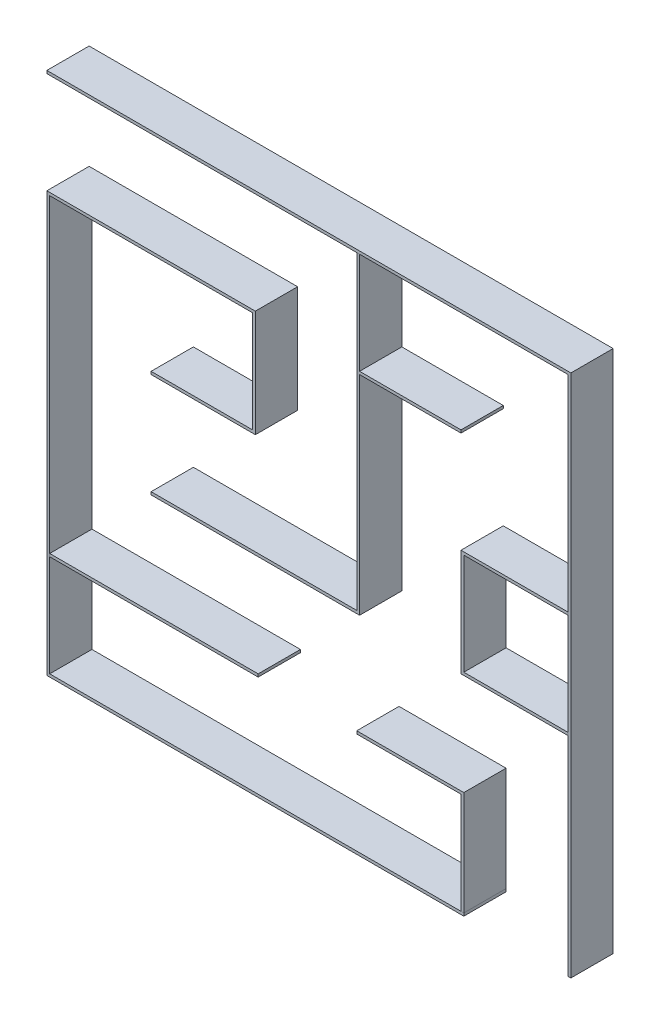
from build123d import *

# Parameters (mm, degrees)
SKETCH1_W           = 1860
SKETCH1_H           = 1860
BOSS_EXTRUDE1_DEPTH = 10
SKETCH2_W           = 1860
SKETCH2_H           = 1860
SKETCH2_W_2         = 1840
SKETCH2_H_2         = 1840
EXTRUDE_THIN1_DEPTH = 150
SKETCH3_W           = 1840
SKETCH3_H           = 10
BOSS_EXTRUDE2_DEPTH = 150
LPATTERN1_COUNT     = 4
LPATTERN1_PITCH     = 370
SKETCH4_W           = 10
SKETCH4_H           = 1840
BOSS_EXTRUDE3_DEPTH = 150
LPATTERN2_COUNT     = 4
LPATTERN2_PITCH     = 370
SKETCH8_W           = 370
SKETCH8_H           = 10
CUT_EXTRUDE6_DEPTH  = 150
SKETCH9_W           = 370
SKETCH9_H           = 10
CUT_EXTRUDE7_DEPTH  = 150
SKETCH10_W          = 360
SKETCH10_H          = 10
CUT_EXTRUDE8_DEPTH  = 150
SKETCH11_W          = 360
SKETCH11_H          = 10
CUT_EXTRUDE9_DEPTH  = 150
SKETCH12_W          = 10
SKETCH12_H          = 730
CUT_EXTRUDE10_DEPTH = 150
SKETCH13_W          = 10
SKETCH13_H          = 360
CUT_EXTRUDE11_DEPTH = 150
SKETCH14_W          = 10
SKETCH14_H          = 360
CUT_EXTRUDE12_DEPTH = 150
SKETCH15_W          = 10
SKETCH15_H          = 360
CUT_EXTRUDE13_DEPTH = 150
SKETCH16_W          = 10
SKETCH16_H          = 360
CUT_EXTRUDE14_DEPTH = 150
SKETCH17_W          = 350
SKETCH17_H          = 10
CUT_EXTRUDE15_DEPTH = 150
SKETCH18_W          = 10
SKETCH18_H          = 360
CUT_EXTRUDE16_DEPTH = 150
SKETCH19_W          = 10
SKETCH19_H          = 360
CUT_EXTRUDE17_DEPTH = 150
SKETCH20_W          = 10
SKETCH20_H          = 730
CUT_EXTRUDE18_DEPTH = 150
SKETCH21_W          = 350
SKETCH21_H          = 10
CUT_EXTRUDE19_DEPTH = 150
SKETCH22_W          = 10
SKETCH22_H          = 360
CUT_EXTRUDE20_DEPTH = 150
SKETCH23_W          = 350
SKETCH23_H          = 10
CUT_EXTRUDE21_DEPTH = 150
SKETCH24_W          = 360.035966522
SKETCH24_H          = 10
CUT_EXTRUDE22_DEPTH = 150
SKETCH25_W          = 10
SKETCH25_H          = 360
CUT_EXTRUDE23_DEPTH = 150
SKETCH26_W          = 10
SKETCH26_H          = 360
CUT_EXTRUDE24_DEPTH = 150
SKETCH27_W          = 360
SKETCH27_H          = 10
CUT_EXTRUDE25_DEPTH = 150
SKETCH28_W          = 370
SKETCH28_H          = 10
CUT_EXTRUDE26_DEPTH = 150
SKETCH30_W          = 10
SKETCH30_H          = 370
CUT_EXTRUDE29_DEPTH = 150
SKETCH31_W          = 10
SKETCH31_H          = 360
CUT_EXTRUDE30_DEPTH = 150
SKETCH32_W          = 1860
SKETCH32_H          = 1860
CUT_EXTRUDE33_DEPTH = 10
SKETCH33_W          = 10
SKETCH33_H          = 10
CUT_EXTRUDE34_DEPTH = 1324.744688375
SKETCH34_W          = 150
SKETCH34_H          = 10
BOSS_EXTRUDE4_DEPTH = 10


with BuildPart() as part:
    # Sketch1 → Boss-Extrude1 (new body)
    with BuildSketch(Plane.XY):
        Rectangle(SKETCH1_W, SKETCH1_H)
    extrude(amount=BOSS_EXTRUDE1_DEPTH)

    # Sketch3 → Boss-Extrude2 (add)
    with BuildSketch(Plane.XY.offset(10)):
        with Locations((0, -555)):
            Rectangle(SKETCH3_W, SKETCH3_H)
    boss_extrude2 = extrude(amount=BOSS_EXTRUDE2_DEPTH)

    # LPattern1: Boss-Extrude2 ×4
    with Locations(*[(0, i * LPATTERN1_PITCH, 0) for i in range(1, LPATTERN1_COUNT)]):
        add(boss_extrude2)

    # Sketch4 → Boss-Extrude3 (add)
    with BuildSketch(Plane.XY.offset(10)):
        with Locations((545, 0)):
            Rectangle(SKETCH4_W, SKETCH4_H)
    boss_extrude3 = extrude(amount=BOSS_EXTRUDE3_DEPTH)

    # LPattern2: Boss-Extrude3 ×4
    with Locations(*[(-i * LPATTERN2_PITCH, 0, 0) for i in range(1, LPATTERN2_COUNT)]):
        add(boss_extrude3)

    # Sketch8 → Cut-Extrude6 (cut)
    with BuildSketch(Plane.XY.offset(160)):
        with Locations((735, -555)):
            Rectangle(SKETCH8_W, SKETCH8_H)
    extrude(amount=-CUT_EXTRUDE6_DEPTH, mode=Mode.SUBTRACT)

    # Sketch9 → Cut-Extrude7 (cut)
    with BuildSketch(Plane.XY.offset(160)):
        with Locations((735, 555)):
            Rectangle(SKETCH9_W, SKETCH9_H)
    extrude(amount=-CUT_EXTRUDE7_DEPTH, mode=Mode.SUBTRACT)

    # Sketch10 → Cut-Extrude8 (cut)
    with BuildSketch(Plane.XY.offset(160)):
        with Locations((360, 185)):
            Rectangle(SKETCH10_W, SKETCH10_H)
    extrude(amount=-CUT_EXTRUDE8_DEPTH, mode=Mode.SUBTRACT)

    # Sketch11 → Cut-Extrude9 (cut)
    with BuildSketch(Plane.XY.offset(160)):
        with Locations((360, -185)):
            Rectangle(SKETCH11_W, SKETCH11_H)
    extrude(amount=-CUT_EXTRUDE9_DEPTH, mode=Mode.SUBTRACT)

    # Sketch12 → Cut-Extrude10 (cut)
    with BuildSketch(Plane.XY.offset(160)):
        with Locations((545, 555)):
            Rectangle(SKETCH12_W, SKETCH12_H)
    extrude(amount=-CUT_EXTRUDE10_DEPTH, mode=Mode.SUBTRACT)

    # Sketch13 → Cut-Extrude11 (cut)
    with BuildSketch(Plane.XY.offset(160)):
        with Locations((545, -370)):
            Rectangle(SKETCH13_W, SKETCH13_H)
    extrude(amount=-CUT_EXTRUDE11_DEPTH, mode=Mode.SUBTRACT)

    # Sketch14 → Cut-Extrude12 (cut)
    with BuildSketch(Plane.XY.offset(160)):
        with Locations((-565, -740)):
            Rectangle(SKETCH14_W, SKETCH14_H)
    extrude(amount=-CUT_EXTRUDE12_DEPTH, mode=Mode.SUBTRACT)

    # Sketch15 → Cut-Extrude13 (cut)
    with BuildSketch(Plane.XY.offset(160)):
        with Locations((-195, -740)):
            Rectangle(SKETCH15_W, SKETCH15_H)
    extrude(amount=-CUT_EXTRUDE13_DEPTH, mode=Mode.SUBTRACT)

    # Sketch16 → Cut-Extrude14 (cut)
    with BuildSketch(Plane.XY.offset(160)):
        with Locations((175, -740)):
            Rectangle(SKETCH16_W, SKETCH16_H)
    extrude(amount=-CUT_EXTRUDE14_DEPTH, mode=Mode.SUBTRACT)

    # Sketch17 → Cut-Extrude15 (cut)
    with BuildSketch(Plane.XY.offset(160)):
        with Locations((-5, -555)):
            Rectangle(SKETCH17_W, SKETCH17_H)
    extrude(amount=-CUT_EXTRUDE15_DEPTH, mode=Mode.SUBTRACT)

    # Sketch18 → Cut-Extrude16 (cut)
    with BuildSketch(Plane.XY.offset(160)):
        with Locations((-195, -370)):
            Rectangle(SKETCH18_W, SKETCH18_H)
    extrude(amount=-CUT_EXTRUDE16_DEPTH, mode=Mode.SUBTRACT)

    # Sketch19 → Cut-Extrude17 (cut)
    with BuildSketch(Plane.XY.offset(160)):
        with Locations((-565, -370)):
            Rectangle(SKETCH19_W, SKETCH19_H)
    extrude(amount=-CUT_EXTRUDE17_DEPTH, mode=Mode.SUBTRACT)

    # Sketch20 → Cut-Extrude18 (cut)
    with BuildSketch(Plane.XY.offset(160)):
        with Locations((-565, 185)):
            Rectangle(SKETCH20_W, SKETCH20_H)
    extrude(amount=-CUT_EXTRUDE18_DEPTH, mode=Mode.SUBTRACT)

    # Sketch21 → Cut-Extrude19 (cut)
    with BuildSketch(Plane.XY.offset(160)):
        with Locations((-745, 185)):
            Rectangle(SKETCH21_W, SKETCH21_H)
    extrude(amount=-CUT_EXTRUDE19_DEPTH, mode=Mode.SUBTRACT)

    # Sketch22 → Cut-Extrude20 (cut)
    with BuildSketch(Plane.XY.offset(160)):
        with Locations((-195, 0)):
            Rectangle(SKETCH22_W, SKETCH22_H)
    extrude(amount=-CUT_EXTRUDE20_DEPTH, mode=Mode.SUBTRACT)

    # Sketch23 → Cut-Extrude21 (cut)
    with BuildSketch(Plane.XY.offset(160)):
        with Locations((-5, 185)):
            Rectangle(SKETCH23_W, SKETCH23_H)
    extrude(amount=-CUT_EXTRUDE21_DEPTH, mode=Mode.SUBTRACT)

    # Sketch24 → Cut-Extrude22 (cut)
    with BuildSketch(Plane.XY.offset(160)):
        with Locations((-739.982016739, -185)):
            Rectangle(SKETCH24_W, SKETCH24_H)
    extrude(amount=-CUT_EXTRUDE22_DEPTH, mode=Mode.SUBTRACT)

    # Sketch25 → Cut-Extrude23 (cut)
    with BuildSketch(Plane.XY.offset(160)):
        with Locations((-565, 740)):
            Rectangle(SKETCH25_W, SKETCH25_H)
    extrude(amount=-CUT_EXTRUDE23_DEPTH, mode=Mode.SUBTRACT)

    # Sketch26 → Cut-Extrude24 (cut)
    with BuildSketch(Plane.XY.offset(160)):
        with Locations((-195, 740)):
            Rectangle(SKETCH26_W, SKETCH26_H)
    extrude(amount=-CUT_EXTRUDE24_DEPTH, mode=Mode.SUBTRACT)

    # Sketch27 → Cut-Extrude25 (cut)
    with BuildSketch(Plane.XY.offset(160)):
        with Locations((-10, 555)):
            Rectangle(SKETCH27_W, SKETCH27_H)
    extrude(amount=-CUT_EXTRUDE25_DEPTH, mode=Mode.SUBTRACT)

    # Sketch31 → Cut-Extrude30 (cut)
    with BuildSketch(Plane.XY.offset(160)):
        with Locations((175, -370)):
            Rectangle(SKETCH31_W, SKETCH31_H)
    extrude(amount=-CUT_EXTRUDE30_DEPTH, mode=Mode.SUBTRACT)

    # Sketch32 → Cut-Extrude33 (cut)
    with BuildSketch(Plane.XY.offset(10)):
        Rectangle(SKETCH32_W, SKETCH32_H)
    extrude(amount=-CUT_EXTRUDE33_DEPTH, mode=Mode.SUBTRACT)


with BuildPart() as body_2:
    # Sketch2 → Extrude-Thin1 (new body)
    with BuildSketch(Plane.XY.offset(10)):
        Rectangle(SKETCH2_W, SKETCH2_H)
        Rectangle(SKETCH2_W_2, SKETCH2_H_2, mode=Mode.SUBTRACT)
    extrude(amount=EXTRUDE_THIN1_DEPTH)

    # Sketch28 → Cut-Extrude26 (cut)
    with BuildSketch(Plane.XY.offset(160)):
        with Locations((735, -925)):
            Rectangle(SKETCH28_W, SKETCH28_H)
    extrude(amount=-CUT_EXTRUDE26_DEPTH, mode=Mode.SUBTRACT)

    # Sketch30 → Cut-Extrude29 (cut)
    with BuildSketch(Plane.XY.offset(160)):
        with Locations((-925, 735)):
            Rectangle(SKETCH30_W, SKETCH30_H)
    extrude(amount=-CUT_EXTRUDE29_DEPTH, mode=Mode.SUBTRACT)


with BuildPart() as cut_extrude29_piece_1:
    # of the separate pieces the step leaves, piece 1, a body of its own (cut_extrude29_pieces)
    add(body_2.part.solids().sort_by_distance((930, 930, 10))[0])


with BuildPart() as cut_extrude29_piece_2:
    # of the separate pieces the step leaves, piece 2, a body of its own (cut_extrude29_pieces)
    add(body_2.part.solids().sort_by_distance((-930, -930, 10))[0])



with BuildPart() as cut_extrude33_piece_1:
    # of the separate pieces the step leaves, piece 1, a body of its own (cut_extrude33_pieces)
    add(part.part.solids().sort_by_distance((-559.964033478, -180, 160))[0])


with BuildPart() as cut_extrude33_piece_2:
    # of the separate pieces the step leaves, piece 2, a body of its own (cut_extrude33_pieces)
    add(part.part.solids().sort_by_distance((-180, 190, 10))[0])

    # Sketch33 → Cut-Extrude34 (cut, through all)
    with BuildSketch(Plane(origin=(0, 0, 10), x_dir=(-1, 0, 0), z_dir=(0, 0, -1))):
        with Locations((185, 185)):
            Rectangle(SKETCH33_W, SKETCH33_H)
    extrude(amount=-CUT_EXTRUDE34_DEPTH, mode=Mode.SUBTRACT)


with BuildPart() as cut_extrude33_piece_3:
    # of the separate pieces the step leaves, piece 3, a body of its own (cut_extrude33_pieces)
    add(part.part.solids().sort_by_distance((540, -190, 160))[0])


with BuildPart() as cut_extrude33_piece_4:
    # of the separate pieces the step leaves, piece 4, a body of its own (cut_extrude33_pieces)
    add(part.part.solids().sort_by_distance((550, -550, 10))[0])


with BuildPart() as cut_extrude33_piece_5:
    # of the separate pieces the step leaves, piece 5, a body of its own (cut_extrude33_pieces)
    add(part.part.solids().sort_by_distance((-920, -550, 10))[0])


with BuildPart() as cut_extrude29_piece_2_1:
    add(cut_extrude29_piece_2.part)

    add(cut_extrude33_piece_2.part)  # Boss-Extrude4 merges Cut-Extrude33 piece 2
    # Sketch34 → Boss-Extrude4 (add)
    with BuildSketch(Plane.ZY.offset(920)):
        with Locations((85, 555)):
            Rectangle(SKETCH34_W, SKETCH34_H)
    extrude(amount=BOSS_EXTRUDE4_DEPTH)


solid = Compound([cut_extrude29_piece_1.part, cut_extrude33_piece_1.part, cut_extrude33_piece_3.part, cut_extrude33_piece_4.part, cut_extrude33_piece_5.part, cut_extrude29_piece_2_1.part])
